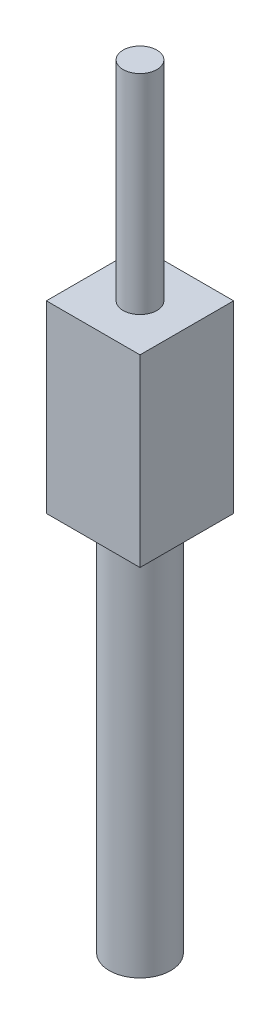
from build123d import *

# Parameters (mm, degrees)
SKETCH1_R           = 5
BOSS_EXTRUDE1_DEPTH = 62
SKETCH3_W           = 15.25
SKETCH3_H           = 15.25
BOSS_EXTRUDE2_DEPTH = 30
SKETCH5_R           = 3
CUT_EXTRUDE1_DEPTH  = 10
SKETCH4_R           = 2.75
BOSS_EXTRUDE3_DEPTH = 34


with BuildPart() as part:
    # Sketch1 → Boss-Extrude1 (new body)
    with BuildSketch(Plane(origin=(0, 0, 0), x_dir=(1, 0, 0), z_dir=(0, 1, 0))):
        with Locations(Location((0, 0, 0), (0, 0, 270))):
            Circle(SKETCH1_R)
    extrude(amount=BOSS_EXTRUDE1_DEPTH)

    # Sketch3 → Boss-Extrude2 (add)
    with BuildSketch(Plane(origin=(0, 62, 0), x_dir=(1, 0, 0), z_dir=(0, 1, 0))):
        Rectangle(SKETCH3_W, SKETCH3_H)
    extrude(amount=BOSS_EXTRUDE2_DEPTH)

    # Sketch5 → Cut-Extrude1 (cut)
    with BuildSketch(Plane.XZ):
        with Locations(Location((0, 0, 0), (0, 0, 270))):
            Circle(SKETCH5_R)
    extrude(amount=-CUT_EXTRUDE1_DEPTH, mode=Mode.SUBTRACT)

    # Sketch4 → Boss-Extrude3 (add)
    with BuildSketch(Plane(origin=(0, 92, 0), x_dir=(1, 0, 0), z_dir=(0, 1, 0))):
        with Locations(Location((0, 0, 0), (0, 0, 270))):
            Circle(SKETCH4_R)
    extrude(amount=BOSS_EXTRUDE3_DEPTH)


solid = part.part
